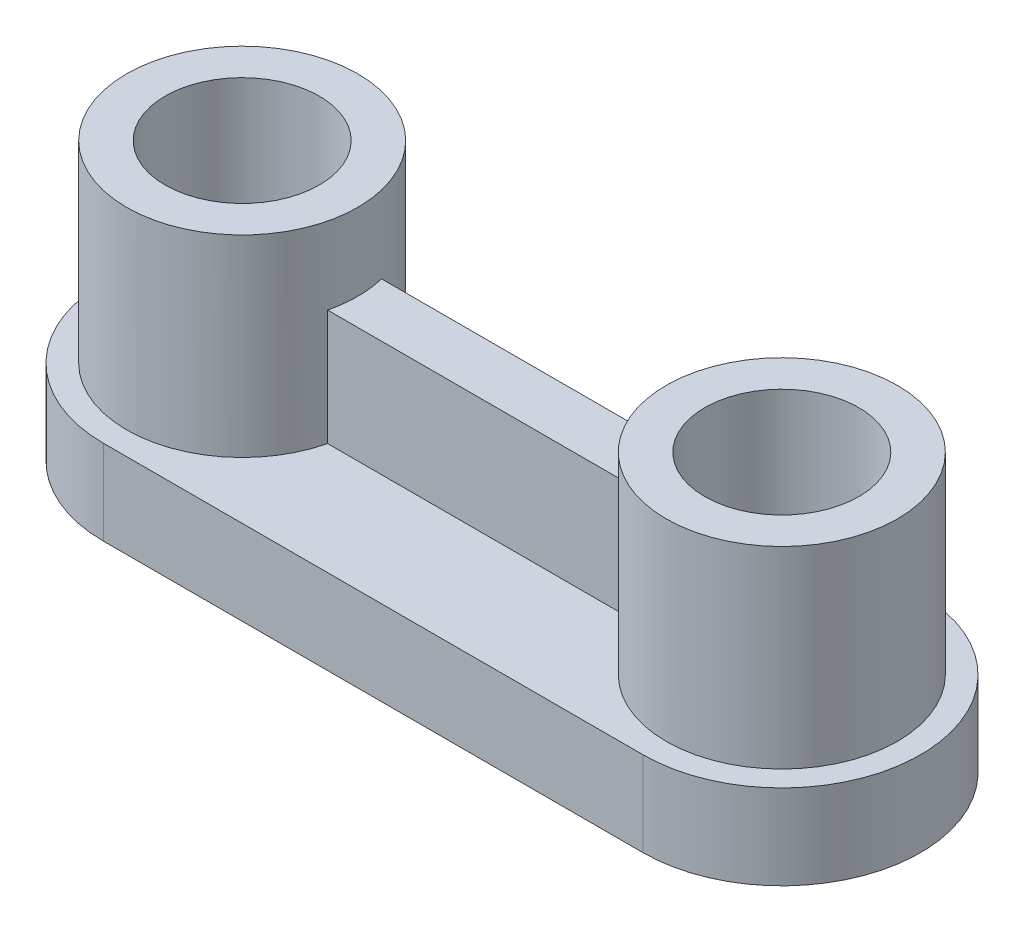
from build123d import *

# Parameters (mm, degrees)
BOSS_EXTRUDE1_DEPTH = 11
SKETCH2_R           = 15
BOSS_EXTRUDE2_DEPTH = 25
SKETCH5_R           = 10
CUT_EXTRUDE1_DEPTH  = 20
SKETCH8_R           = 7.5
CUT_EXTRUDE2_DEPTH  = 93.021736563
SKETCH13_R          = 7.5
CUT_EXTRUDE3_DEPTH  = 93.021736563
SKETCH14_W          = 36
SKETCH14_H          = 20
CUT_EXTRUDE4_DEPTH  = 5
SKETCH18_W          = 40.91
SKETCH18_H          = 7
BOSS_EXTRUDE5_DEPTH = 15


with BuildPart() as part:
    # Sketch1 → Boss-Extrude1 (new body)
    with BuildSketch(Plane(origin=(0, 0, 0), x_dir=(1, 0, 0), z_dir=(0, 1, 0))):
        with BuildLine():
            Line((0, 18), (70, 18))
            ThreePointArc((70, 18), (88, 0), (70, -18))
            Line((70, -18), (0, -18))
            ThreePointArc((0, -18), (-18, 0), (0, 18))
        make_face()
    extrude(amount=BOSS_EXTRUDE1_DEPTH)

    # Sketch2 → Boss-Extrude2 (add)
    with BuildSketch(Plane(origin=(0, 11, 0), x_dir=(1, 0, 0), z_dir=(0, 1, 0))):
        with Locations(Location((0, 0, 0), (0, 0, 270))):
            Circle(SKETCH2_R)
        with Locations(Location((70, 0, 0), (0, 0, 270))):
            Circle(SKETCH2_R)
    extrude(amount=BOSS_EXTRUDE2_DEPTH)

    # Sketch5 → Cut-Extrude1 (cut)
    with BuildSketch(Plane(origin=(0, 36, 0), x_dir=(1, 0, 0), z_dir=(0, 1, 0))):
        with Locations(Location((70, 0, 0), (0, 0, 270))):
            Circle(SKETCH5_R)
        with Locations(Location((0, 0, 0), (0, 0, 270))):
            Circle(SKETCH5_R)
    extrude(amount=-CUT_EXTRUDE1_DEPTH, mode=Mode.SUBTRACT)

    # Sketch8 → Cut-Extrude2 (cut, through all)
    with BuildSketch(Plane(origin=(0, 16, 0), x_dir=(1, 0, 0), z_dir=(0, 1, 0))):
        with Locations(Location((0, 0, 0), (0, 0, 270))):
            Circle(SKETCH8_R)
    extrude(amount=-CUT_EXTRUDE2_DEPTH, mode=Mode.SUBTRACT)

    # Sketch13 → Cut-Extrude3 (cut, through all)
    with BuildSketch(Plane(origin=(0, 16, 0), x_dir=(1, 0, 0), z_dir=(0, 1, 0))):
        with Locations(Location((70, 0, 0), (0, 0, 270))):
            Circle(SKETCH13_R)
    extrude(amount=-CUT_EXTRUDE3_DEPTH, mode=Mode.SUBTRACT)

    # Sketch14 → Cut-Extrude4 (cut)
    with BuildSketch(Plane.XZ):
        with Locations((34.999969462, -0.04623456)):
            Rectangle(SKETCH14_W, SKETCH14_H)
    extrude(amount=-CUT_EXTRUDE4_DEPTH, mode=Mode.SUBTRACT)

    # Sketch18 → Boss-Extrude5 (add)
    with BuildSketch(Plane(origin=(0, 11, 0), x_dir=(1, 0, 0), z_dir=(0, 1, 0))):
        with Locations((35, 0)):
            Rectangle(SKETCH18_W, SKETCH18_H)
    extrude(amount=BOSS_EXTRUDE5_DEPTH)


solid = part.part
